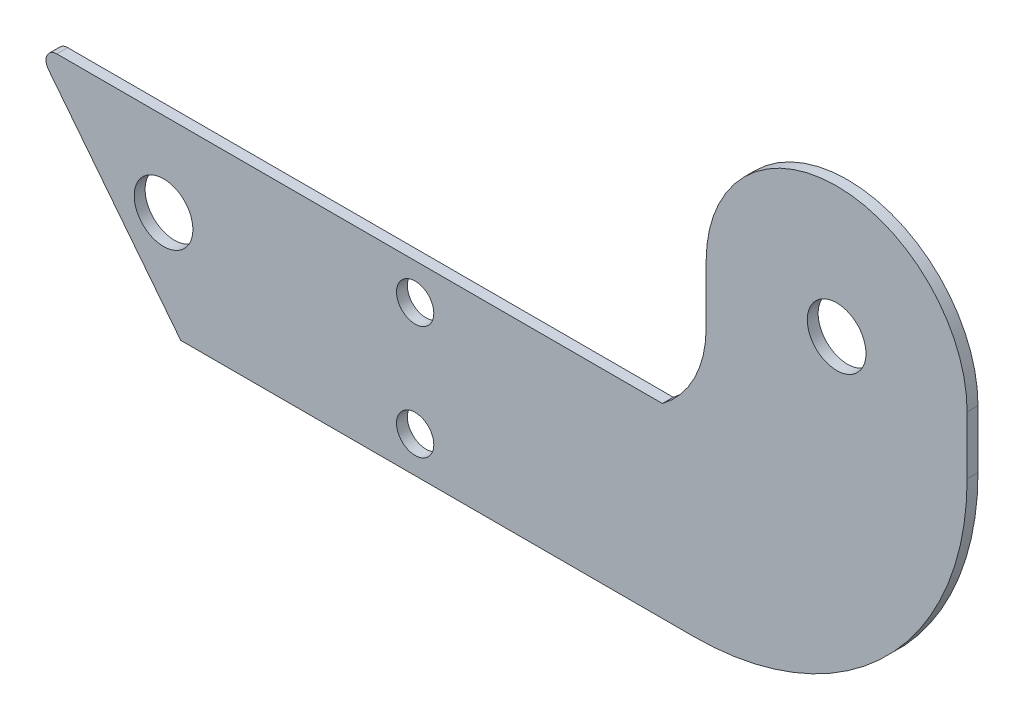
from build123d import *

# Parameters (mm, degrees)
ESBO_O1_R                = 4.05
ESBO_O1_R_2              = 2.574080602
RESSALTO_EXTRUS_O1_DEPTH = 1.5
FILETE1_R                = 1.5


with BuildPart() as part:
    # Esboço1 → Ressalto-extrusão1 (new body)
    with BuildSketch(Plane.XY):
        with BuildLine():
            Line((-18.018564211, 0), (-18.018564211, -8))
            ThreePointArc((-18.018564211, -8), (-19.612515049, -14.728881473), (-24.055610328, -20.027695444))
            Line((-24.055610328, -20.027695444), (-110.751402368, -20.027695444))
            Line((-110.751402368, -20.027695444), (-90.563626469, -45.733186479))
            Line((-90.563626469, -45.733186479), (-19.714622268, -45.733186479))
            ThreePointArc((-19.714622268, -45.733186479), (6.966769767, -34.681392035), (18.018564211, -8))
            Line((18.018564211, -8), (18.018564211, 0))
            ThreePointArc((18.018564211, 0), (0, 18.018564211), (-18.018564211, 0))
        make_face()
        Circle(ESBO_O1_R, mode=Mode.SUBTRACT)
        with Locations((-58.195334888, -25.027695444)):
            Circle(ESBO_O1_R_2, mode=Mode.SUBTRACT)
        with Locations((-58.195334888, -40.733186479)):
            Circle(ESBO_O1_R_2, mode=Mode.SUBTRACT)
        with Locations((-92.935045512, -31.639829044)):
            Circle(ESBO_O1_R, mode=Mode.SUBTRACT)
    extrude(amount=RESSALTO_EXTRUS_O1_DEPTH)

    # Filete1
    filete1_edges = [part.edges().sort_by_distance(p)[0] for p in [
        (-110.751402368, -20.027695444, 0.75),
    ]]
    fillet(filete1_edges, radius=FILETE1_R)


solid = part.part
